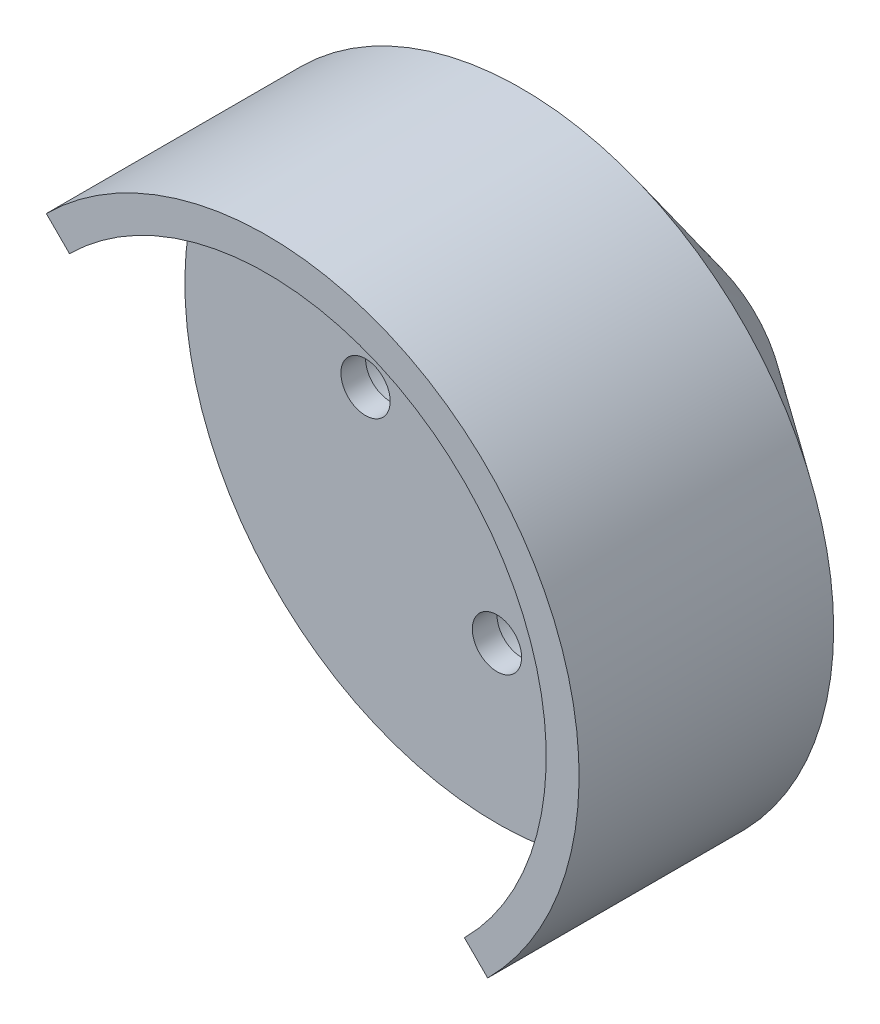
from build123d import *

# Parameters (mm, degrees)
CROQUIS1_R              = 19
CROQUIS1_R_2            = 1.5
SALIENTE_EXTRUIR1_DEPTH = 1.5
SALIENTE_EXTRUIR2_DEPTH = 14
SALIENTE_EXTRUIR3_START = 10
CROQUIS3_R              = 19
CROQUIS3_R_2            = 3
SALIENTE_EXTRUIR3_DEPTH = 10


with BuildPart() as part:
    # Croquis1 → Saliente-Extruir1 (new body)
    with BuildSketch(Plane.XY):
        with Locations((-84.957007, 9.639802)):
            Circle(CROQUIS1_R)
        with Locations((-84.957007, 19.139802)):
            Circle(CROQUIS1_R_2, mode=Mode.SUBTRACT)
        with Locations((-92.957007, 9.639802)):
            Circle(CROQUIS1_R_2, mode=Mode.SUBTRACT)
        with Locations((-84.957007, 0.139802)):
            Circle(CROQUIS1_R_2, mode=Mode.SUBTRACT)
        with Locations((-76.957007, 9.639802)):
            Circle(CROQUIS1_R_2, mode=Mode.SUBTRACT)
    extrude(amount=SALIENTE_EXTRUIR1_DEPTH)

    # Croquis2 → Saliente-Extruir2 (add)
    with BuildSketch(Plane.XY.offset(1.5)):
        with BuildLine():
            Line((-98.392036, 23.074831), (-96.977823, 21.660617))
            ThreePointArc((-96.977823, 21.660617), (-72.936192, 21.660617), (-72.936192, -2.381013))
            Line((-72.936192, -2.381013), (-71.521978, -3.795227))
            ThreePointArc((-71.521978, -3.795227), (-71.521978, 23.074831), (-98.392036, 23.074831))
        make_face()
    extrude(amount=SALIENTE_EXTRUIR2_DEPTH)

    # Croquis3 → Saliente-Extruir3 (add)
    with BuildSketch(Plane(origin=(0, 0, 0), x_dir=(-1, 0, 0), z_dir=(0, 0, -1)).offset(SALIENTE_EXTRUIR3_START)):
        with Locations((84.957007, 9.639802)):
            Circle(CROQUIS3_R)
        with Locations((84.957007, 0.139802)):
            Circle(CROQUIS3_R_2, mode=Mode.SUBTRACT)
        with Locations((76.957007, 9.639802)):
            Circle(CROQUIS3_R_2, mode=Mode.SUBTRACT)
        with Locations((92.957007, 9.639802)):
            Circle(CROQUIS3_R_2, mode=Mode.SUBTRACT)
        with Locations((84.957007, 19.139802)):
            Circle(CROQUIS3_R_2, mode=Mode.SUBTRACT)
    extrude(amount=-SALIENTE_EXTRUIR3_DEPTH)

    # Croquis5 → Cortar-Revolución1 (revolve, cut)
    with BuildSketch(Plane(origin=(0, 9.639802, 0), x_dir=(-1, 0, 0), z_dir=(0, -1, 0)), mode=Mode.PRIVATE) as cortar_revoluci_n1_sk:
        Polygon((90.957007, 10), (103.957007, 0), (103.957007, 10), align=None)
    revolve(cortar_revoluci_n1_sk.sketch.rotate(Axis((-84.957007, 9.639802, 0), (0, 0, -1)), 45), axis=Axis((-84.957007, 9.639802, 0), (0, 0, -1)), mode=Mode.SUBTRACT)


solid = part.part
